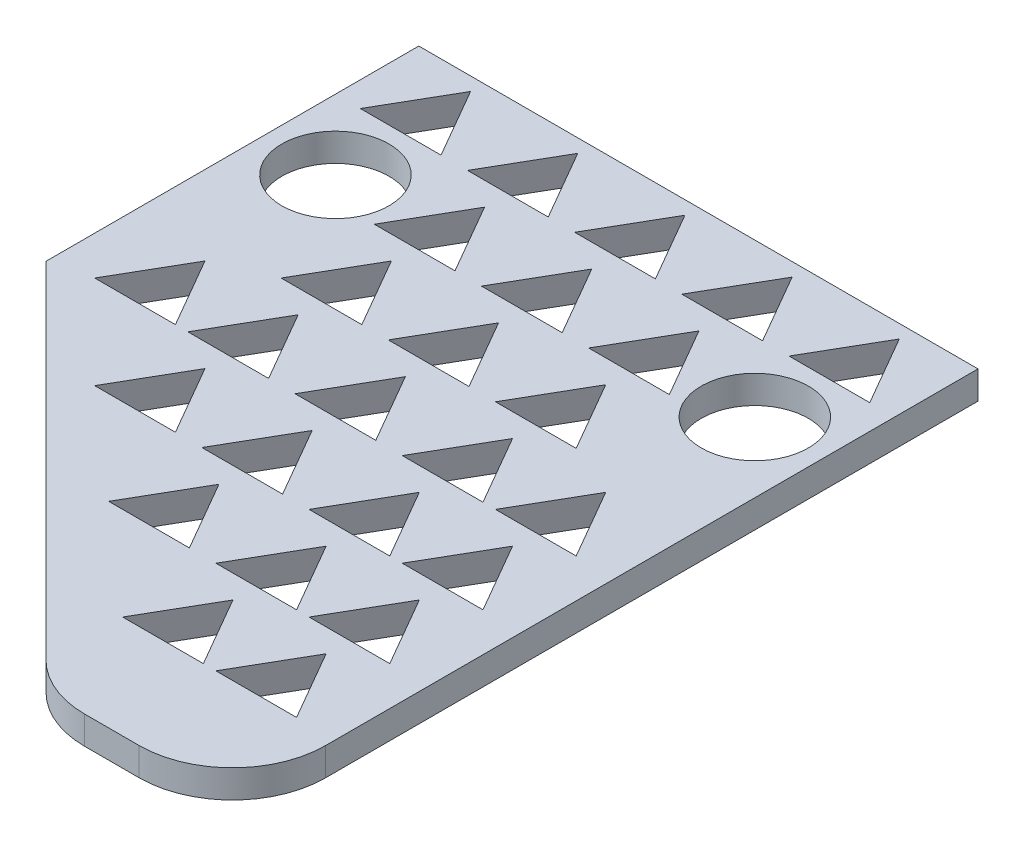
from build123d import *

# Parameters (mm, degrees)
SKETCH9_W           = 152.4
SKETCH9_H           = 203.2
BOSS_EXTRUDE4_DEPTH = 7.62
SKETCH10_R          = 14.605
CUT_EXTRUDE4_DEPTH  = 7.62
CUT_EXTRUDE5_DEPTH  = 7.62
FILLET2_R           = 25.4
CUT_EXTRUDE6_DEPTH  = 7.62


with BuildPart() as part:
    # Sketch9 → Boss-Extrude4 (new body)
    with BuildSketch(Plane(origin=(0, 0, 0), x_dir=(1, 0, 0), z_dir=(0, 1, 0))):
        with Locations((76.2, -101.6)):
            Rectangle(SKETCH9_W, SKETCH9_H)
    extrude(amount=BOSS_EXTRUDE4_DEPTH)

    # Sketch10 → Cut-Extrude4 (cut)
    with BuildSketch(Plane(origin=(0, 7.62, 0), x_dir=(1, 0, 0), z_dir=(0, 1, 0))):
        with Locations(Location((19.05, -41.770926028, 0), (0, 0, 270))):
            Circle(SKETCH10_R)
        with Locations(Location((133.35, -41.770926028, 0), (0, 0, 270))):
            Circle(SKETCH10_R)
    extrude(amount=-CUT_EXTRUDE4_DEPTH, mode=Mode.SUBTRACT)

    # Sketch11 → Cut-Extrude5 (cut)
    with BuildSketch(Plane(origin=(0, 7.62, 0), x_dir=(1, 0, 0), z_dir=(0, 1, 0))):
        Polygon((0, -101.6), (101.6, -203.2), (0, -203.2), align=None)
    extrude(amount=-CUT_EXTRUDE5_DEPTH, mode=Mode.SUBTRACT)

    # Fillet2
    fillet2_edges = [part.edges().sort_by_distance(p)[0] for p in [
        (101.6, 3.81, 203.2),
        (152.4, 3.81, 203.2),
    ]]
    fillet(fillet2_edges, radius=FILLET2_R)

    # Sketch12 → Cut-Extrude6 (cut)
    with BuildSketch(Plane(origin=(0, 7.62, 0), x_dir=(1, 0, 0), z_dir=(0, 1, 0))):
        Polygon((17.78, -3.670926028), (6.781477372, -22.720926028), (28.778522628, -22.720926028), align=None)
        Polygon((35.991477372, -22.720926028), (57.988522628, -22.720926028), (46.99, -3.670926028), align=None)
        Polygon((65.201477372, -22.720926028), (87.198522628, -22.720926028), (76.2, -3.670926028), align=None)
        Polygon((94.411477372, -22.720926028), (116.408522628, -22.720926028), (105.41, -3.670926028), align=None)
        Polygon((123.621477372, -22.720926028), (145.618522628, -22.720926028), (134.62, -3.670926028), align=None)
        Polygon((35.991477372, -48.120926028), (57.988522628, -48.120926028), (46.99, -29.070926028), align=None)
        Polygon((35.991477372, -73.520926028), (57.988522628, -73.520926028), (46.99, -54.470926028), align=None)
        Polygon((35.991477372, -98.920926028), (57.988522628, -98.920926028), (46.99, -79.870926028), align=None)
        Polygon((35.991477372, -124.320926028), (57.988522628, -124.320926028), (46.99, -105.270926028), align=None)
        Polygon((65.201477372, -48.120926028), (87.198522628, -48.120926028), (76.2, -29.070926028), align=None)
        Polygon((105.41, -29.070926028), (94.411477372, -48.120926028), (116.408522628, -48.120926028), align=None)
        Polygon((65.201477372, -73.520926028), (87.198522628, -73.520926028), (76.2, -54.470926028), align=None)
        Polygon((105.41, -54.470926028), (94.411477372, -73.520926028), (116.408522628, -73.520926028), align=None)
        Polygon((65.201477372, -98.920926028), (87.198522628, -98.920926028), (76.2, -79.870926028), align=None)
        Polygon((105.41, -79.870926028), (94.411477372, -98.920926028), (116.408522628, -98.920926028), align=None)
        Polygon((65.201477372, -124.320926028), (87.198522628, -124.320926028), (76.2, -105.270926028), align=None)
        Polygon((105.41, -105.270926028), (94.411477372, -124.320926028), (116.408522628, -124.320926028), align=None)
        Polygon((65.201477372, -149.720926028), (87.198522628, -149.720926028), (76.2, -130.670926028), align=None)
        Polygon((105.41, -130.670926028), (94.411477372, -149.720926028), (116.408522628, -149.720926028), align=None)
        Polygon((130.81, -79.870926028), (119.811477372, -98.920926028), (141.808522628, -98.920926028), align=None)
        Polygon((130.81, -105.270926028), (119.811477372, -124.320926028), (141.808522628, -124.320926028), align=None)
        Polygon((130.81, -130.670926028), (119.811477372, -149.720926028), (141.808522628, -149.720926028), align=None)
        Polygon((105.41, -156.070926028), (94.411477372, -175.120926028), (116.408522628, -175.120926028), align=None)
        Polygon((130.81, -156.070926028), (119.811477372, -175.120926028), (141.808522628, -175.120926028), align=None)
        Polygon((10.591477372, -98.920926028), (32.588522628, -98.920926028), (21.59, -79.870926028), align=None)
    extrude(amount=-CUT_EXTRUDE6_DEPTH, mode=Mode.SUBTRACT)


solid = part.part
